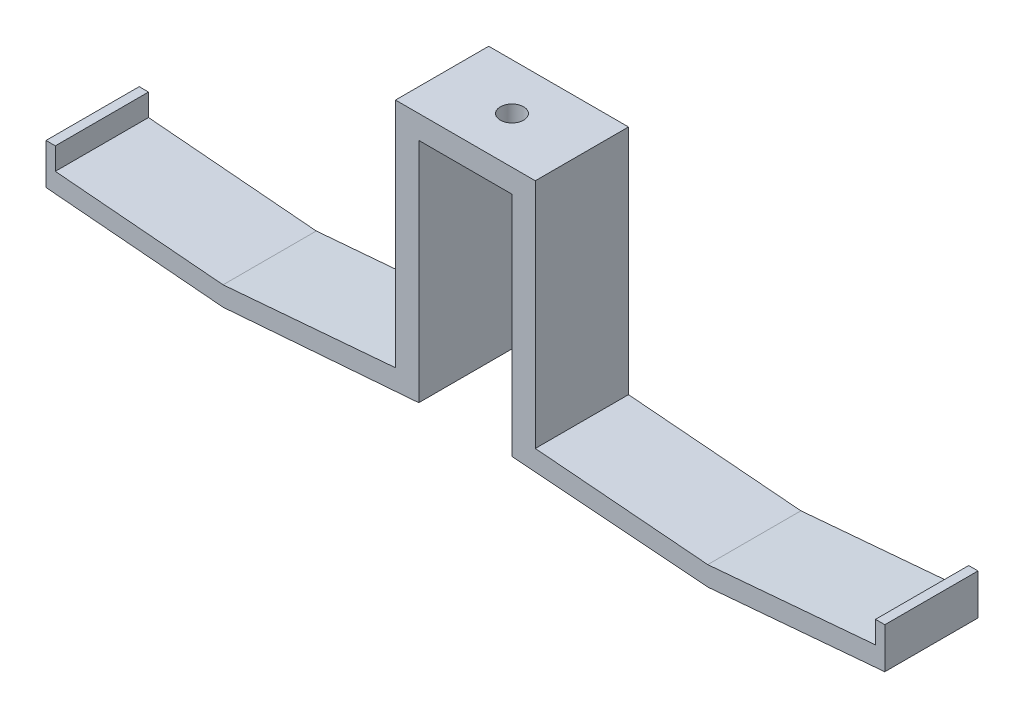
from build123d import *

# Parameters (mm, degrees)
BOSS_EXTRUDE1_DEPTH             = 25.4
F_1_4_0_25_DIAMETER_HOLE1_D     = 6.35
F_1_4_0_25_DIAMETER_HOLE1_DEPTH = 50.8
F_1_4_0_25_DIAMETER_HOLE1_TIP   = 1.907732465


with BuildPart() as part:
    # Sketch2 → Boss-Extrude1 (new body)
    with BuildSketch(Plane.XY):
        Polygon((0, 0), (12.7, 0), (12.7, -61.9179737), (66.04, -66.051353419), (114.3, -61.9179737), (114.3, -50.811353419), (111.76, -50.811353419), (111.76, -56.8379737), (66.04, -60.753807118), (19.05, -56.8379737), (19.05, 0), (19.05, 6.35), (0, 6.35), align=None)
        Polygon((-12.7, 0), (0, 0), (0, 6.35), (-19.05, 6.35), (-19.05, 0), (-19.05, -56.8379737), (-66.04, -60.753807118), (-111.76, -56.8379737), (-111.76, -50.811353419), (-114.3, -50.811353419), (-114.3, -61.9179737), (-66.04, -66.051353419), (-12.7, -61.9179737), align=None)
    extrude(amount=BOSS_EXTRUDE1_DEPTH)

    # 1/4 (0.25) Diameter Hole1
    with Locations(Plane(origin=(0, 6.35, 0), x_dir=(1, 0, 0), z_dir=(0, 1, 0))):
        with Locations((0, -12.7)):
            Hole(F_1_4_0_25_DIAMETER_HOLE1_D / 2, depth=F_1_4_0_25_DIAMETER_HOLE1_DEPTH)
            with Locations((0, 0, -(F_1_4_0_25_DIAMETER_HOLE1_DEPTH + F_1_4_0_25_DIAMETER_HOLE1_TIP / 2))):  # 118° drill point
                Cone(0, F_1_4_0_25_DIAMETER_HOLE1_D / 2, F_1_4_0_25_DIAMETER_HOLE1_TIP, mode=Mode.SUBTRACT)


solid = part.part
